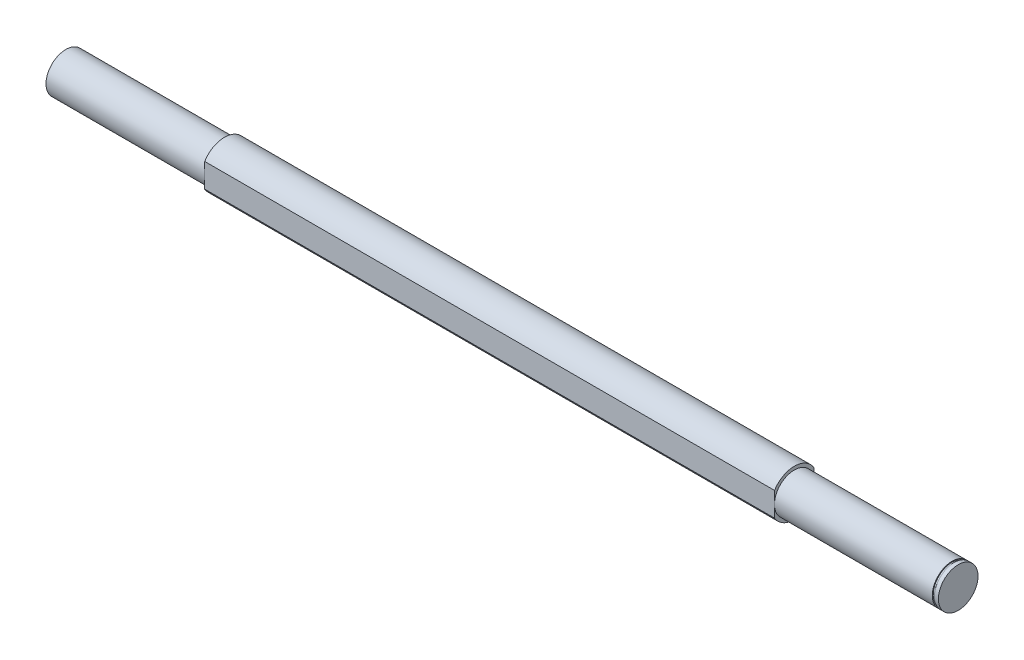
from build123d import *

# Parameters (mm, degrees)
CUT_EXTRUDE1_DEPTH = 431
CUT_EXTRUDE2_DEPTH = 4
SKETCH4_W          = 1.6
SKETCH4_H          = 0.7
CUT_EXTRUDE3_DEPTH = 5


with BuildPart() as part:
    # Sketch1 → Revolve1 (revolve)
    with BuildSketch(Plane.XY, mode=Mode.PRIVATE) as revolve1_sk:
        Polygon((-337.5, 0), (337.5, 0), (337.5, 15), (213.5, 15), (213.5, 17.5), (-217.5, 17.5), (-217.5, 15), (-337.5, 15), align=None)
    revolve(revolve1_sk.sketch.rotate(Axis((-337.5, 0, 0), (1, 0, 0)), 90), axis=Axis((-337.5, 0, 0), (1, 0, 0)))

    # Sketch2 → Cut-Extrude1 (cut)
    with BuildSketch(Plane.ZY.offset(217.5)):
        with BuildLine():
            Line((-14.936600675, 9.118550338), (-15.062665819, -8.908765258))
            ThreePointArc((-15.062665819, -8.908765258), (-17.499572122, 0.12237463), (-14.936600675, 9.118550338))
        make_face()
        with BuildLine():
            Line((14.936600675, 9.118550338), (15.062665819, -8.908765258))
            ThreePointArc((15.062665819, -8.908765258), (17.499572122, 0.12237463), (14.936600675, 9.118550338))
        make_face()
    extrude(amount=-CUT_EXTRUDE1_DEPTH, mode=Mode.SUBTRACT)

    # Sketch3 → Cut-Extrude2 (cut)
    with BuildSketch(Plane.XY.offset(-15)):
        with BuildLine():
            Line((-331.5, 4), (-311.5, 4))
            ThreePointArc((-311.5, 4), (-307.5, 0), (-311.5, -4))
            Line((-311.5, -4), (-331.5, -4))
            ThreePointArc((-331.5, -4), (-335.5, 0), (-331.5, 4))
        make_face()
    extrude(amount=CUT_EXTRUDE2_DEPTH, mode=Mode.SUBTRACT)

    # Sketch4 → Cut-Revolve1 (revolve, cut)
    with BuildSketch(Plane.XY, mode=Mode.PRIVATE) as cut_revolve1_sk:
        with Locations((333.7, 14.65)):
            Rectangle(SKETCH4_W, SKETCH4_H)
    revolve(cut_revolve1_sk.sketch.rotate(Axis((337.5, 0, 0), (-1, 0, 0)), 270.400663256), axis=Axis((337.5, 0, 0), (-1, 0, 0)), mode=Mode.SUBTRACT)

    # Sketch5 → Cut-Extrude3 (cut)
    with BuildSketch(Plane.XY.offset(-15)):
        with BuildLine():
            Line((324.5, -5), (289.5, -5))
            ThreePointArc((289.5, -5), (284.5, 0), (289.5, 5))
            Line((289.5, 5), (324.5, 5))
            ThreePointArc((324.5, 5), (329.5, 0), (324.5, -5))
        make_face()
    extrude(amount=CUT_EXTRUDE3_DEPTH, mode=Mode.SUBTRACT)


solid = part.part
